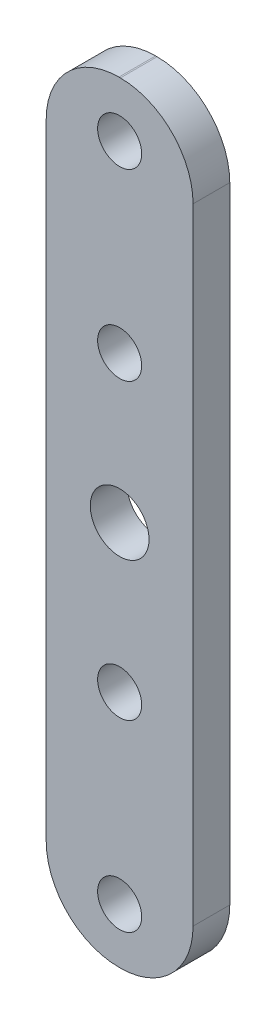
from build123d import *

# Parameters (mm, degrees)
SKETCH1_R           = 4
SKETCH1_R_2         = 3
BOSS_EXTRUDE1_DEPTH = 5


with BuildPart() as part:
    # Sketch1 → Boss-Extrude1 (new body)
    with BuildSketch(Plane.XY):
        with BuildLine():
            Line((9.9, 0), (10.1, 0))
            ThreePointArc((10.1, 0), (17.100357134, 2.899642866), (20, 9.9))
            Line((20, 9.9), (20, 95.1))
            ThreePointArc((20, 95.1), (17.100357134, 102.100357134), (10.1, 105))
            Line((10.1, 105), (9.9, 105))
            ThreePointArc((9.9, 105), (2.899642866, 102.100357134), (0, 95.1))
            Line((0, 95.1), (0, 9.9))
            ThreePointArc((0, 9.9), (2.899642866, 2.899642866), (9.9, 0))
        make_face()
        with Locations((10, 52.5)):
            Circle(SKETCH1_R, mode=Mode.SUBTRACT)
        with Locations((10, 97.5)):
            Circle(SKETCH1_R_2, mode=Mode.SUBTRACT)
        with Locations((10, 7.5)):
            Circle(SKETCH1_R_2, mode=Mode.SUBTRACT)
        with Locations((10, 32.5)):
            Circle(SKETCH1_R_2, mode=Mode.SUBTRACT)
        with Locations((10, 72.5)):
            Circle(SKETCH1_R_2, mode=Mode.SUBTRACT)
    extrude(amount=BOSS_EXTRUDE1_DEPTH)


solid = part.part
